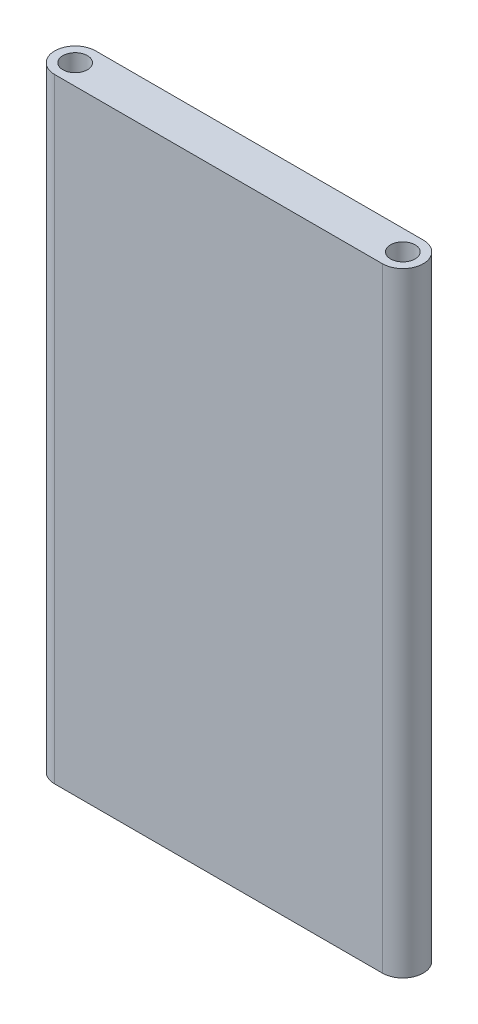
from build123d import *

# Parameters (mm, degrees)
SKETCH1_R           = 3.81
BOSS_EXTRUDE1_DEPTH = 95.25


with BuildPart() as part:
    # Sketch1 → Boss-Extrude1 (new, symmetric)
    with BuildSketch(Plane(origin=(0, 0, 0), x_dir=(1, 0, 0), z_dir=(0, 1, 0))):
        with BuildLine():
            Line((0, 6.35), (50.8, 6.35))
            ThreePointArc((50.8, 6.35), (57.15, 0), (50.8, -6.35))
            Line((50.8, -6.35), (-50.8, -6.35))
            ThreePointArc((-50.8, -6.35), (-57.15, 0), (-50.8, 6.35))
            Line((-50.8, 6.35), (0, 6.35))
        make_face()
        with Locations(Location((-50.8, 0, 0), (0, 0, 270))):
            Circle(SKETCH1_R, mode=Mode.SUBTRACT)
        with Locations(Location((50.8, 0, 0), (0, 0, 90))):
            Circle(SKETCH1_R, mode=Mode.SUBTRACT)
    extrude(amount=BOSS_EXTRUDE1_DEPTH, both=True)


solid = part.part
